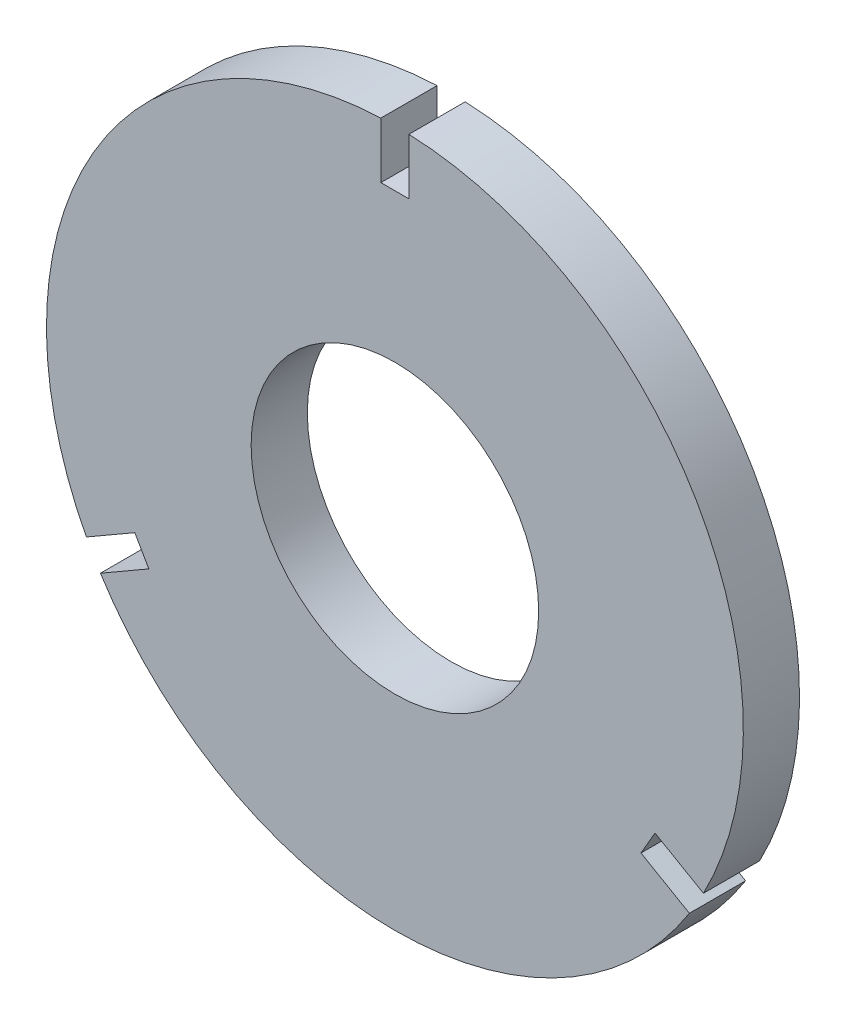
from build123d import *

# Parameters (mm, degrees)
SKETCH2_R           = 37.2
SKETCH2_R_2         = 15.35
BOSS_EXTRUDE1_DEPTH = 6
SKETCH3_W           = 3
SKETCH3_H           = 6
CUT_EXTRUDE1_DEPTH  = 6


with BuildPart() as part:
    # Sketch2 → Boss-Extrude1 (new body)
    with BuildSketch(Plane.XY):
        Circle(SKETCH2_R)
        Circle(SKETCH2_R_2, mode=Mode.SUBTRACT)
    extrude(amount=BOSS_EXTRUDE1_DEPTH)

    # Sketch3 → Cut-Extrude1 (cut)
    with BuildSketch(Plane.XY.offset(6)):
        with Locations((0, 34.2)):
            Rectangle(SKETCH3_W, SKETCH3_H)
        Polygon((26.269992598, -16.899038106), (31.466145021, -19.899038106), (32.966145021, -17.300961894), (27.769992598, -14.300961894), align=None)
        Polygon((-27.769992598, -14.300961894), (-32.966145021, -17.300961894), (-31.466145021, -19.899038106), (-26.269992598, -16.899038106), align=None)
    extrude(amount=-CUT_EXTRUDE1_DEPTH, mode=Mode.SUBTRACT)


solid = part.part
